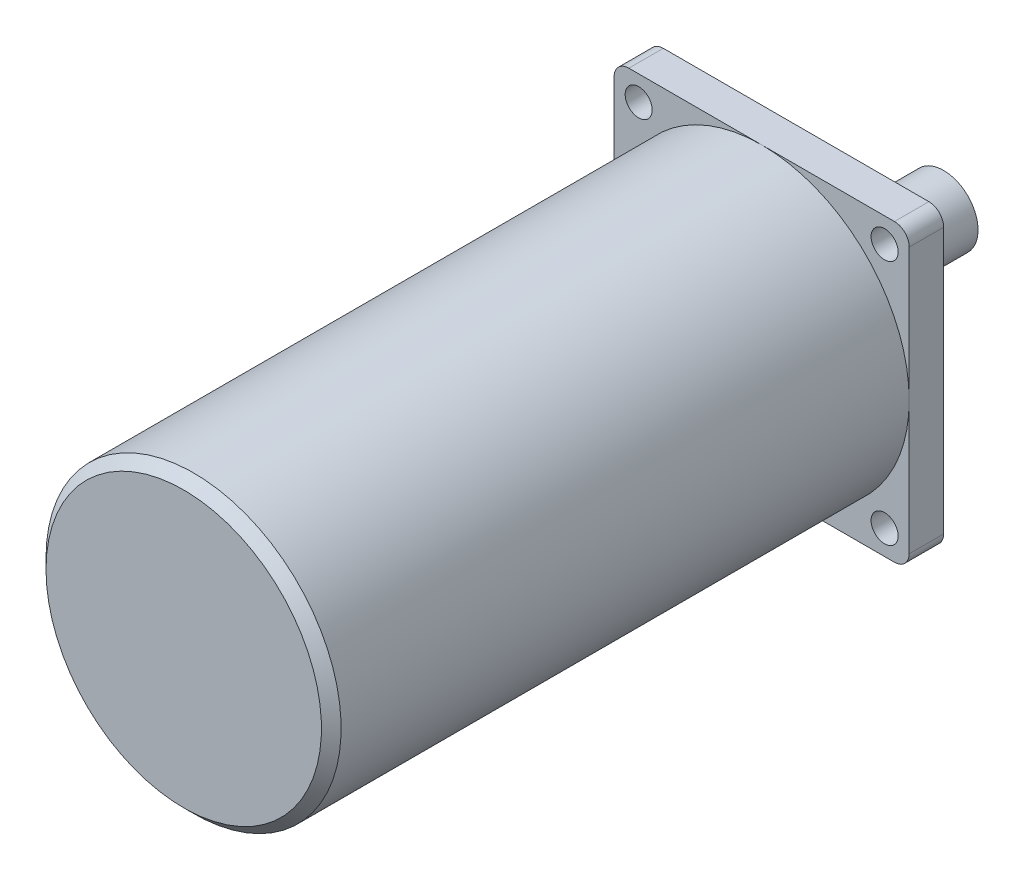
from build123d import *

# Parameters (mm, degrees)
SKETCH_1_W               = 60.00000000000001
SKETCH_1_H               = 60.00000000000001
EXTRUDE_1_DEPTH          = 124.5
SKETCH_2_R               = 25
EXTRUDE_2_DEPTH          = 3
SKETCH_3_R               = 6.999999999999999
EXTRUDE_3_DEPTH          = 27
FILLET_1_R               = 3
CUT_EXTRUDE_1_DEPTH      = 117.5
PATTERN_CIRCULAR_1_COUNT = 4
CHAMFER_1_SIZE           = 2
SKETCH_5_R               = 2.75
SKETCH_5_R_2             = 2.7500000000000018
SKETCH_5_R_3             = 2.7500000000000004
SKETCH_5_R_4             = 2.750000000000002
CUT_EXTRUDE_2_DEPTH      = 151.66602138504885


with BuildPart() as part:
    # 草圖1 → 伸長1 (new body)
    with BuildSketch(Plane.XY):
        with Locations((30.000000000000004, 30.000000000000004)):
            Rectangle(SKETCH_1_W, SKETCH_1_H)
    extrude(amount=EXTRUDE_1_DEPTH)

    # 草圖2 → 伸長2 (add)
    with BuildSketch(Plane(origin=(0, 0, 0), x_dir=(-1, 0, 0), z_dir=(0, 0, -1))):
        with Locations((-30.000000000000007, 30)):
            Circle(SKETCH_2_R)
    extrude(amount=EXTRUDE_2_DEPTH)

    # 草圖3 → 伸長3 (add)
    with BuildSketch(Plane(origin=(0, 0, -3), x_dir=(-1, 0, 0), z_dir=(0, 0, -1))):
        with Locations((-30.000000000000007, 30)):
            Circle(SKETCH_3_R)
    extrude(amount=EXTRUDE_3_DEPTH)

    # 圓角1
    fillet_1_edges = [part.edges().sort_by_distance(p)[0] for p in [
        (0, 60, 62.25),
        (60, 60, 62.25),
        (60, 0, 62.25),
        (0, 0, 62.25),
    ]]
    fillet(fillet_1_edges, radius=FILLET_1_R)

    # 草圖4 → 除料-伸長1 (cut)
    with BuildSketch(Plane.XY.offset(124.5)):
        with BuildLine():
            Line((60, 3), (60, 30.000000000000007))
            ThreePointArc((60, 30.000000000000007), (51.213203435596434, 8.786796564403577), (30, 0))
            Line((30, 0), (56.99999999999999, 0))
            ThreePointArc((56.99999999999999, 0), (59.12132034355964, 0.8786796564403576), (60, 3))
        make_face()
    cut_extrude_1 = extrude(amount=-CUT_EXTRUDE_1_DEPTH, mode=Mode.SUBTRACT)

    # 環狀複製排列1: 除料-伸長1 ×4 about axis
    pattern_circular_1_axis = Axis((30, 30, 0), (0, 0, 1))
    for i in range(1, PATTERN_CIRCULAR_1_COUNT):
        add(cut_extrude_1.rotate(pattern_circular_1_axis, i * 360 / PATTERN_CIRCULAR_1_COUNT), mode=Mode.SUBTRACT)

    # 導角1
    chamfer_1_edges = [part.edges().sort_by_distance(p)[0] for p in [
        (29.999999999999982, 59.99999999999999, 124.5),
    ]]
    chamfer(chamfer_1_edges, length=CHAMFER_1_SIZE)

    # 草圖5 → 除料-伸長2 (cut, through all)
    with BuildSketch(Plane(origin=(0, 0, 0), x_dir=(-1, 0, 0), z_dir=(0, 0, -1))):
        with Locations((-4.999999999999972, 4.999999999999999)):
            Circle(SKETCH_5_R)
        with Locations((-54.99999999999997, 4.999999999999987)):
            Circle(SKETCH_5_R_2)
        with Locations((-4.99999999999997, 54.99999999999999)):
            Circle(SKETCH_5_R_3)
        with Locations((-55, 54.99999999999998)):
            Circle(SKETCH_5_R_4)
    extrude(amount=-CUT_EXTRUDE_2_DEPTH, mode=Mode.SUBTRACT)


solid = part.part
